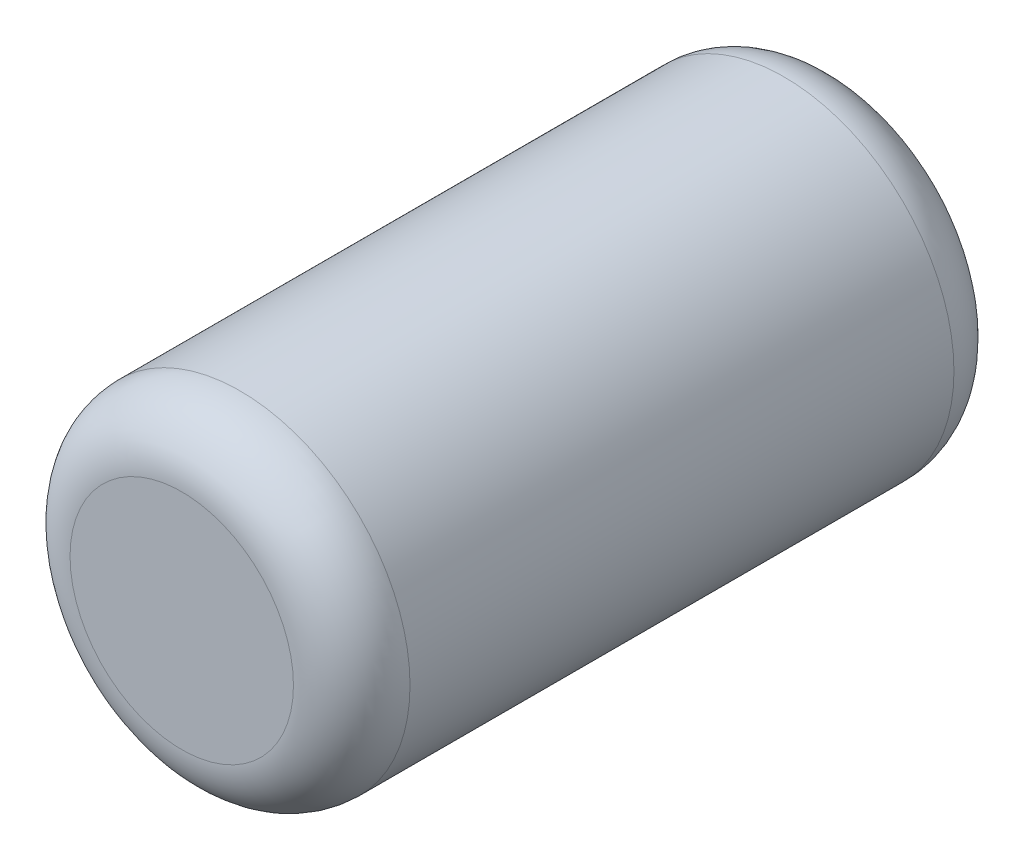
from build123d import *

# Parameters (mm, degrees)
SKETCH2_R           = 8.75
BOSS_EXTRUDE1_DEPTH = 34
FILLET1_R           = 3


with BuildPart() as part:
    # Sketch2 → Boss-Extrude1 (new body)
    with BuildSketch(Plane.XY):
        Circle(SKETCH2_R)
    extrude(amount=BOSS_EXTRUDE1_DEPTH)

    # Fillet1
    fillet1_edges = [part.edges().sort_by_distance(p)[0] for p in [
        (-8.75, 0, 0),
        (-8.75, 0, 34),
    ]]
    fillet(fillet1_edges, radius=FILLET1_R)


solid = part.part
